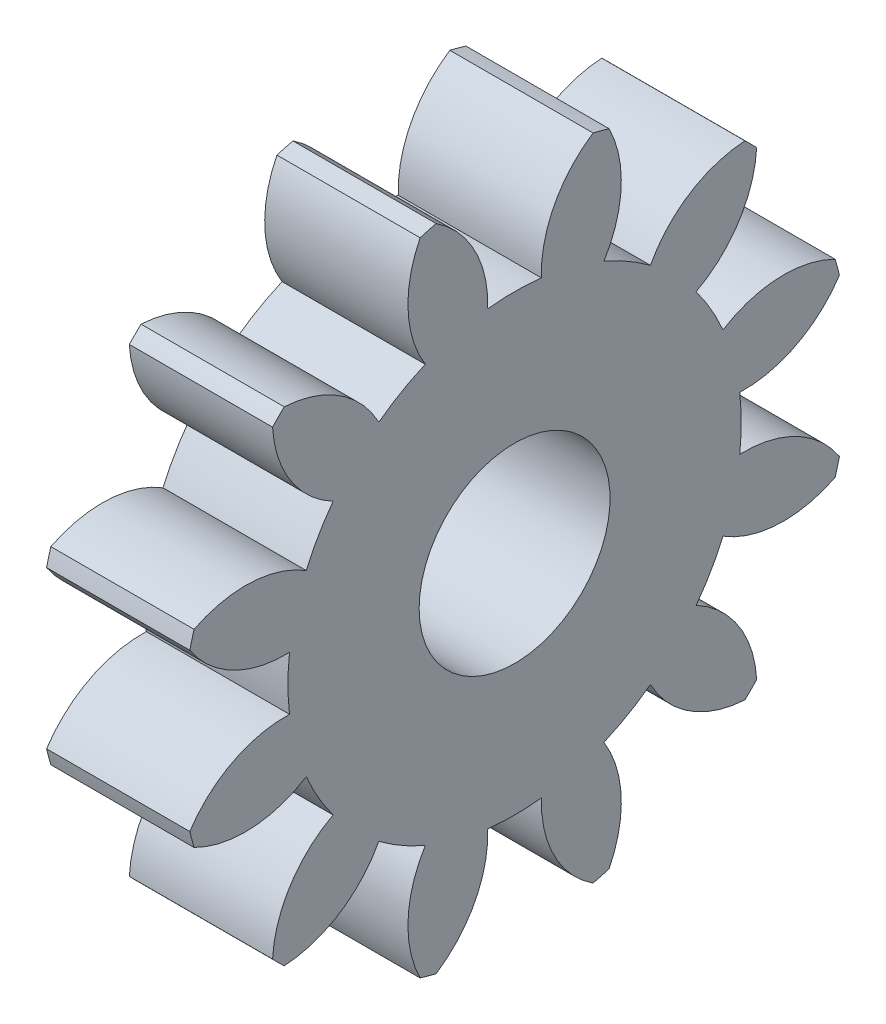
from build123d import *

# Parameters (mm, degrees)
BASPROSKE_W           = 12
BASPROSKE_H           = 7
TOOTHCUT_DEPTH        = 16.556349186
TEETHCUTS_COUNT       = 12
TEETHCUTS_ANGLE       = 330
BORSKE_R              = 2
BORE_DEPTH            = 50.0000508
CROQUIS1_W            = 15.345589461
CROQUIS1_H            = 15.379984963
CORTAR_EXTRUIR1_DEPTH = 9


with BuildPart() as part:
    # BasProSke → Base-Revolve (revolve)
    with BuildSketch(Plane(origin=(0, 0, 0), x_dir=(1, 0, 0), z_dir=(0, 1, 0)), mode=Mode.PRIVATE) as base_revolve_sk:
        with Locations((6, 3.5)):
            Rectangle(BASPROSKE_W, BASPROSKE_H)
    revolve(base_revolve_sk.sketch.rotate(Axis((-10, 0, 0), (1, 0, 0)), 180), axis=Axis((-10, 0, 0), (1, 0, 0)))

    # TooCutSke → ToothCut (cut, through all)
    with BuildSketch(Plane(origin=(0, 0, 0), x_dir=(0, 0, -1), z_dir=(1, 0, 0))):
        with BuildLine():
            ThreePointArc((0.562207301, 4.715604304), (0, 4.749), (-0.562207301, 4.715604304))
            ThreePointArc((-0.562207301, 4.715604304), (-0.837528627, 5.917009812), (-1.672850686, 6.823328788))
            ThreePointArc((-1.672850686, 6.823328788), (0, 7.0254), (1.672850686, 6.823328788))
            ThreePointArc((1.672850686, 6.823328788), (0.837528627, 5.917009812), (0.562207301, 4.715604304))
        make_face()
    toothcut = extrude(amount=TOOTHCUT_DEPTH, mode=Mode.SUBTRACT)

    # TeethCuts: ToothCut ×12 about axis
    teethcuts_axis = Axis((-10, 0, 0), (1, 0, 0))
    for i in range(1, TEETHCUTS_COUNT):
        add(toothcut.rotate(teethcuts_axis, i * TEETHCUTS_ANGLE / (TEETHCUTS_COUNT - 1)), mode=Mode.SUBTRACT)

    # BorSke → Bore (cut, symmetric)
    with BuildSketch(Plane(origin=(0, 0, 0), x_dir=(0, 0, -1), z_dir=(1, 0, 0))):
        with Locations(Location((0, 0, 0), (0, 0, 180))):
            Circle(BORSKE_R)
    extrude(amount=BORE_DEPTH, both=True, mode=Mode.SUBTRACT)

    # Croquis1 → Cortar-Extruir1 (cut)
    with BuildSketch(Plane.ZY):
        with Locations((-0.072898647, 0.053242763)):
            Rectangle(CROQUIS1_W, CROQUIS1_H)
    extrude(amount=-CORTAR_EXTRUIR1_DEPTH, mode=Mode.SUBTRACT)


solid = part.part
